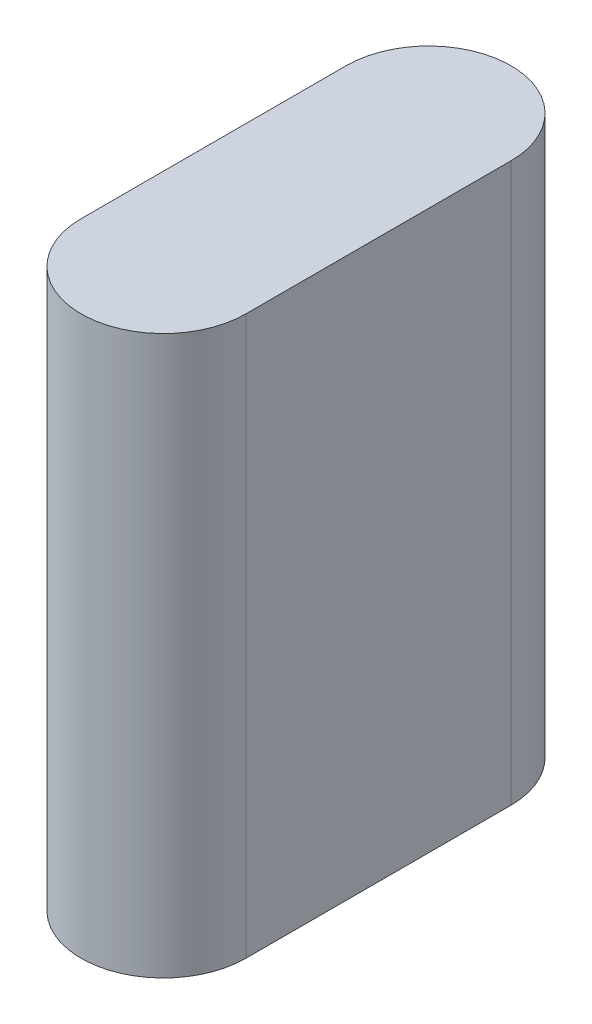
from build123d import *

# Parameters (mm, degrees)
BOSS_EXTRUDE1_DEPTH = 101.6


with BuildPart() as part:
    # Sketch1 → Boss-Extrude1 (new body)
    with BuildSketch(Plane(origin=(0, 0, 0), x_dir=(1, 0, 0), z_dir=(0, 1, 0))):
        with BuildLine():
            Line((-15, 0), (-15, 48.26))
            ThreePointArc((-15, 48.26), (0, 63.26), (15, 48.26))
            Line((15, 48.26), (15, 0))
            ThreePointArc((15, 0), (0, -15), (-15, 0))
        make_face()
    extrude(amount=BOSS_EXTRUDE1_DEPTH)


solid = part.part
